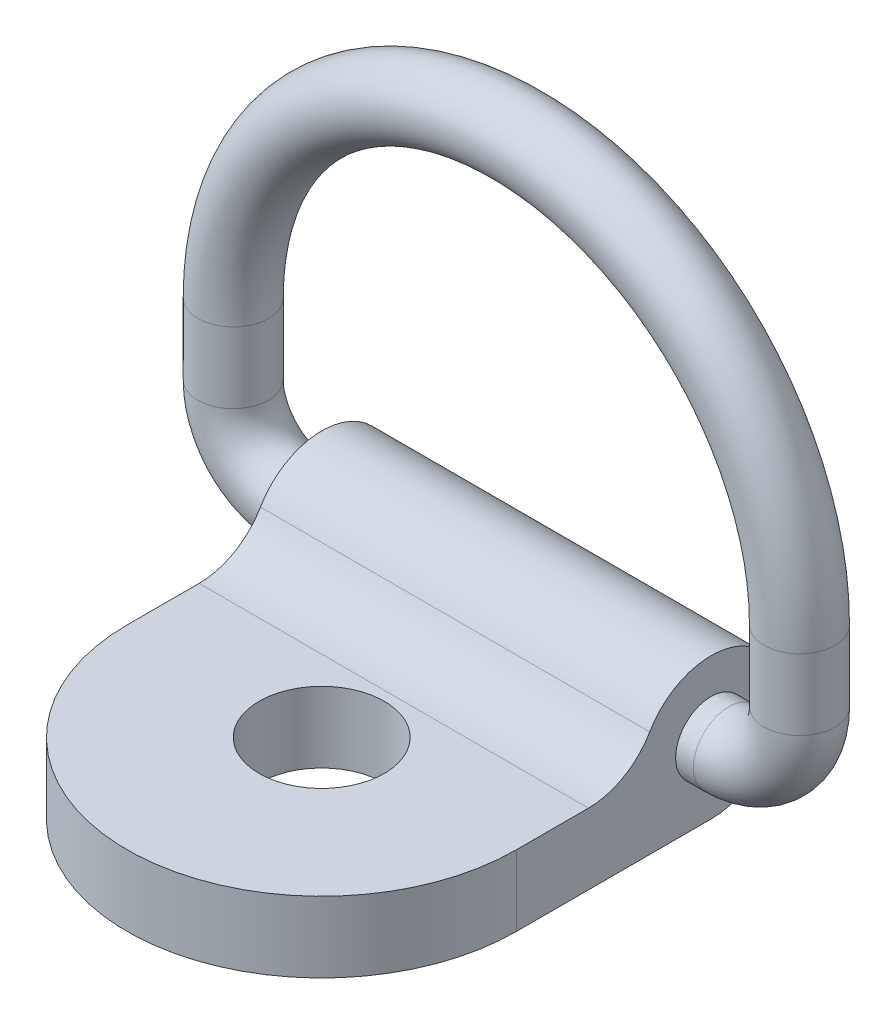
from build123d import *

# Parameters (mm, degrees)
SKETCH3_R                  = 1.5875
SKETCH4_R                  = 1.5875
BOSS_EXTRUDE1_DEPTH        = 8.73125
FILLET1_RADIUS             = 8.73125
FILLET1_LENGTH             = 3.175
F_2_0_221_DIAMETER_HOLE1_D = 5.6134


with BuildPart() as part:
    # Sweep1: sweep along a path in Sketch2
    with BuildLine(Plane.XY) as sweep1_path:
        Line((-9.525, 0), (9.525, 0))
        ThreePointArc((9.525, 0), (11.77006403, 0.92993597), (12.7, 3.175))
        Line((12.7, 3.175), (12.7, 6.35))
        ThreePointArc((12.7, 6.35), (0, 19.05), (-12.7, 6.35))
        Line((-12.7, 6.35), (-12.7, 3.175))
        ThreePointArc((-12.7, 3.175), (-11.77006403, 0.92993597), (-9.525, 0))
    # Sketch3 → Sweep1 (sweep)
    with BuildSketch(Plane(origin=(0, 0, 0), x_dir=(0, 0, -1), z_dir=(1, 0, 0))):
        Circle(SKETCH3_R)
    sweep(path=sweep1_path.line)

    # Sketch4 → Boss-Extrude1 (add, symmetric)
    with BuildSketch(Plane(origin=(0, 0, 0), x_dir=(0, 0, -1), z_dir=(1, 0, 0))):
        with BuildLine():
            Line((-17.4625, -3.175), (0, -3.175))
            ThreePointArc((0, -3.175), (2.749630657, 1.5875), (-2.749630657, 1.5875))
            ThreePointArc((-2.749630657, 1.5875), (-3.911761314, 0.425369343), (-5.499261314, 0))
            Line((-5.499261314, 0), (-17.4625, 0))
            Line((-17.4625, 0), (-17.4625, -3.175))
        make_face()
        with Locations(Location((0, 0, 0), (0, 0, 180))):
            Circle(SKETCH4_R, mode=Mode.SUBTRACT)
    extrude(amount=BOSS_EXTRUDE1_DEPTH, both=True)

    # Fillet1: full round fillet: the end face becomes a half cylinder, R = half its width
    fillet1_face = Plane((0, -1.5875, 17.4625), x_dir=(0, 1, 0), z_dir=(0, 0, 1))  # on the end face: x along it, z out of the body
    fillet1_slab = fillet1_face.offset(-FILLET1_RADIUS / 2) * Box(FILLET1_LENGTH, 2 * FILLET1_RADIUS, FILLET1_RADIUS, mode=Mode.PRIVATE)  # the body's end, R deep
    fillet1_round = Plane((0, -1.5875, 8.73125), x_dir=(0, 0, 1), z_dir=(0, 1, 0)) * Cylinder(FILLET1_RADIUS, FILLET1_LENGTH, mode=Mode.PRIVATE)  # its axis R under the face
    add(fillet1_slab - fillet1_round, mode=Mode.SUBTRACT)

    # #2 (0.221) Diameter Hole1 (through all)
    with Locations(Plane(origin=(0, 0, 0), x_dir=(1, 0, 0), z_dir=(0, 1, 0))):
        with Locations((0, -8.73125)):
            Hole(F_2_0_221_DIAMETER_HOLE1_D / 2)


solid = part.part
